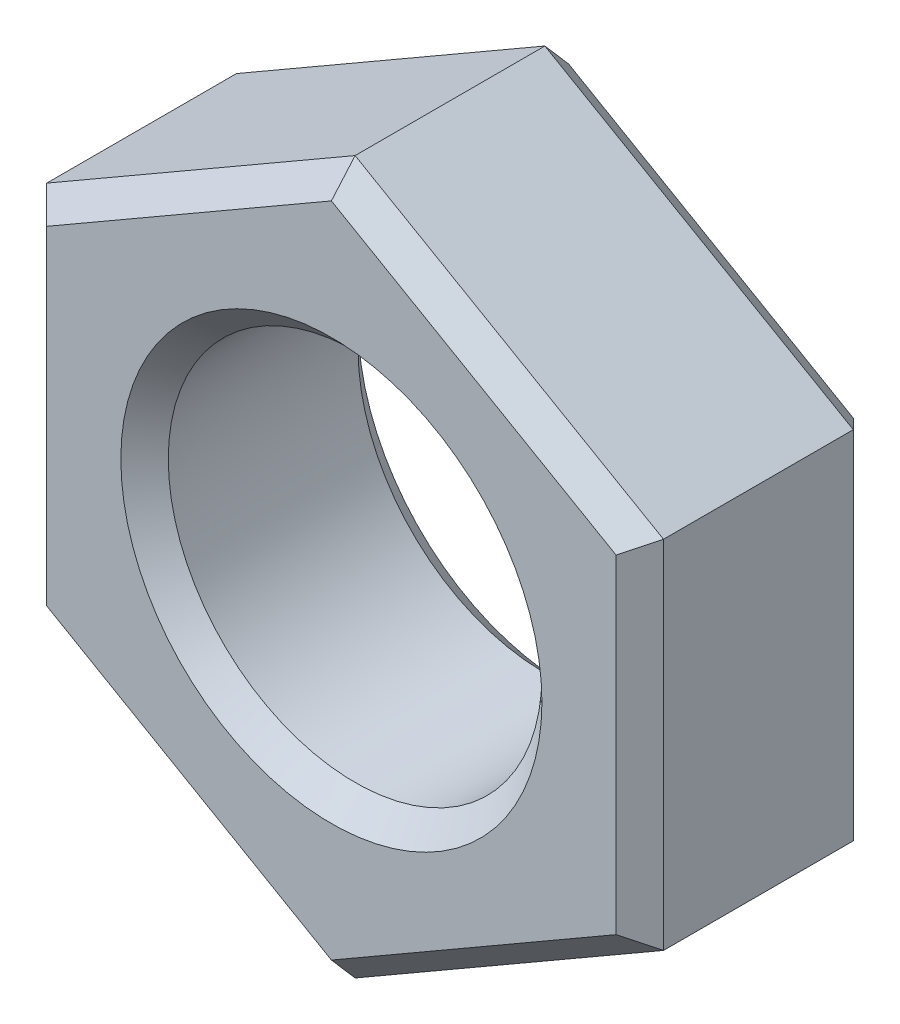
from build123d import *

# Parameters (mm, degrees)
SKETCH1_R           = 1.575
BOSS_EXTRUDE1_DEPTH = 1
DEBURS_SIZE         = 0.2


with BuildPart() as part:
    # Sketch1 → Boss-Extrude1 (new, symmetric)
    with BuildSketch(Plane.XY):
        Polygon((2.6, -1.5011107), (2.6, 1.5011107), (0, 3.0022214), (-2.6, 1.5011107), (-2.6, -1.5011107), (0, -3.0022214), align=None)
        Circle(SKETCH1_R, mode=Mode.SUBTRACT)
    extrude(amount=BOSS_EXTRUDE1_DEPTH, both=True)

    # Deburs
    deburs_edges = [part.edges().sort_by_distance(p)[0] for p in [
        (1.3, 2.25166605, 1),
        (-1.3, 2.25166605, 1),
        (-1.575, 0, -1),
        (-1.575, 0, 1),
        (-2.6, 0, 1),
        (-1.3, -2.25166605, 1),
        (1.3, -2.25166605, 1),
        (-1.3, -2.25166605, -1),
        (-2.6, 0, -1),
        (-1.3, 2.25166605, -1),
        (1.3, 2.25166605, -1),
        (2.6, 0, -1),
        (1.3, -2.25166605, -1),
        (2.6, 0, 1),
    ]]
    chamfer(deburs_edges, length=DEBURS_SIZE)


solid = part.part
